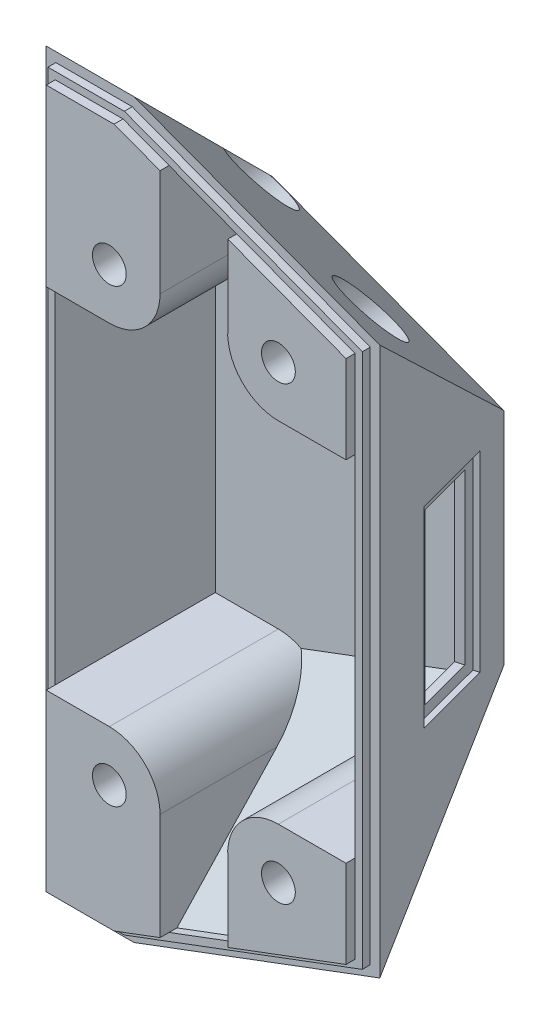
from build123d import *

# Parameters (mm, degrees)
BOSS_EXTRUDE1_DEPTH     = 0.889
SKETCH8_W               = 6.35
SKETCH8_H               = 19.05
CUT_EXTRUDE2_DEPTH      = 5.08
SKETCH9_W               = 8.89
SKETCH9_H               = 21.59
CUT_EXTRUDE3_DEPTH      = 0.635
CUT_EXTRUDE4_DEPTH      = 2.54
CUT_EXTRUDE4_DEPTH_BACK = 0.254
SKETCH10_W              = 11.176
SKETCH10_H              = 30.48
SKETCH10_W_2            = 6.35
SKETCH10_H_2            = 19.05
BOSS_EXTRUDE2_REACH     = 95.096
SKETCH12_R              = 3.81
CUT_EXTRUDE5_DEPTH      = 16.51
SKETCH13_R              = 1.905
CUT_EXTRUDE6_DEPTH      = 93.196752065


with BuildPart() as part:
    # Sketch2 → Boss-Extrude1 (new body)
    with BuildSketch(Plane.XY):
        Polygon((1.0795, 81.4705), (1.0795, 1.0795), (9.69330013, 1.0795), (36.5125, 11.136699951), (36.5125, 71.413300049), (9.69330013, 81.4705), align=None)
        Polygon((9.543608433, 1.905), (1.905, 1.905), (1.905, 80.645), (9.543608433, 80.645), (35.687, 70.841228162), (35.687, 11.708771838), align=None, mode=Mode.SUBTRACT)
    extrude(amount=BOSS_EXTRUDE1_DEPTH)

    # Sketch4 → Loft2 section 0
    with BuildSketch(Plane.XY.offset(-19.05)):
        with BuildLine():
            Line((0, 63.5), (0, 19.05))
            Line((0, 19.05), (6.434627029, 19.05))
            Line((6.434627029, 19.05), (32.512, 28.829014864))
            Line((32.512, 28.829014864), (32.512, 53.720985136))
            Line((32.512, 53.720985136), (6.434627029, 63.5))
            Line((6.434627029, 63.5), (0, 63.5))
        make_face()
    # Sketch2<7> → Loft2 section 1
    with BuildSketch(Plane.XY):
        with BuildLine():
            Line((0, 82.55), (0, 0))
            Line((0, 0), (9.889050811, 0))
            Line((9.889050811, 0), (37.592, 10.388605946))
            Line((37.592, 10.388605946), (37.592, 72.161394054))
            Line((37.592, 72.161394054), (9.889050811, 82.55))
            Line((9.889050811, 82.55), (0, 82.55))
        make_face()
    loft()

    # Sketch2<8> → Cut-Loft1 section 0
    with BuildSketch(Plane.XY):
        with BuildLine():
            Line((1.905, 1.905), (1.905, 80.645))
            Line((1.905, 80.645), (9.543608433, 80.645))
            Line((9.543608433, 80.645), (35.687, 70.841228162))
            Line((35.687, 70.841228162), (35.687, 11.708771838))
            Line((35.687, 11.708771838), (9.543608433, 1.905))
            Line((9.543608433, 1.905), (1.905, 1.905))
        make_face()
    # Sketch5 → Cut-Loft1 section 1
    with BuildSketch(Plane.XY.offset(-17.145)):
        with BuildLine():
            Line((31.115, 28.305139864), (31.115, 54.244860136))
            Line((31.115, 54.244860136), (6.434627029, 63.5))
            Line((6.434627029, 63.5), (1.905, 63.5))
            Line((1.905, 63.5), (1.905, 19.05))
            Line((1.905, 19.05), (6.434627029, 19.05))
            Line((6.434627029, 19.05), (31.115, 28.305139864))
        make_face()
    loft(mode=Mode.SUBTRACT)

    # Sketch8 → Cut-Extrude2 (cut)
    with BuildSketch(Plane(origin=(35.09626556, 0, -9.359004149), x_dir=(-0.257662650560332, 0, -0.9662349396012465), z_dir=(0.9662349396012465, 0, -0.257662650560332))):
        with Locations((1.774647504, 41.275)):
            Rectangle(SKETCH8_W, SKETCH8_H)
    extrude(amount=-CUT_EXTRUDE2_DEPTH, mode=Mode.SUBTRACT)

    # Sketch9 → Cut-Extrude3 (cut)
    with BuildSketch(Plane(origin=(35.09626556, 0, -9.359004149), x_dir=(-0.257662650560332, 0, -0.9662349396012465), z_dir=(0.9662349396012465, 0, -0.257662650560332))):
        with Locations((1.774647504, 41.275)):
            Rectangle(SKETCH9_W, SKETCH9_H)
    extrude(amount=-CUT_EXTRUDE3_DEPTH, mode=Mode.SUBTRACT)

    # Sketch10 → Cut-Extrude4 (cut, two sides: drawn at the far end of the back side and taken through both)
    with BuildSketch(Plane(origin=(33.317738589, 0, -8.88473029), x_dir=(0.25766265056032145, 0, 0.9662349396012492), z_dir=(-0.9662349396012492, 0, 0.25766265056032145)).offset(-CUT_EXTRUDE4_DEPTH_BACK)):
        with Locations((-1.774647504, 41.275)):
            Rectangle(SKETCH10_W, SKETCH10_H)
        with Locations((-1.774647504, 41.275)):
            Rectangle(SKETCH10_W_2, SKETCH10_H_2, mode=Mode.SUBTRACT)
    extrude(amount=CUT_EXTRUDE4_DEPTH + CUT_EXTRUDE4_DEPTH_BACK, mode=Mode.SUBTRACT)

    # Sketch11 → Boss-Extrude2 (add, up to next)
    with BuildSketch(Plane.XY.offset(1.905), mode=Mode.PRIVATE) as boss_extrude2_sk1:
        with BuildLine():
            ThreePointArc((14.732, 15.875), (13.058115254, 19.916115254), (9.017, 21.59))
            Line((9.017, 21.59), (1.905, 21.59))
            Line((1.905, 21.59), (1.905, 1.905))
            Line((1.905, 1.905), (9.543608433, 1.905))
            Line((9.543608433, 1.905), (14.732, 3.850646838))
            Line((14.732, 3.850646838), (14.732, 15.875))
        make_face()
    boss_extrude2_tool1 = extrude(boss_extrude2_sk1.sketch, amount=-BOSS_EXTRUDE2_REACH, mode=Mode.PRIVATE) - part.part
    # Sketch11 → Boss-Extrude2 (add, up to next)
    with BuildSketch(Plane.XY.offset(1.905), mode=Mode.PRIVATE) as boss_extrude2_sk2:
        with BuildLine():
            ThreePointArc((28.067, 21.59), (23.903603678, 19.790016738), (22.362794824, 15.523904134))
            Line((22.362794824, 15.523904134), (22.362794824, 6.712194896))
            Line((22.362794824, 6.712194896), (35.687, 11.708771838))
            Line((35.687, 11.708771838), (35.687, 21.59))
            Line((35.687, 21.59), (28.067, 21.59))
        make_face()
    boss_extrude2_tool2 = extrude(boss_extrude2_sk2.sketch, amount=-BOSS_EXTRUDE2_REACH, mode=Mode.PRIVATE) - part.part
    # Sketch11 → Boss-Extrude2 (add, up to next)
    with BuildSketch(Plane.XY.offset(1.905), mode=Mode.PRIVATE) as boss_extrude2_sk3:
        with BuildLine():
            Line((1.905, 60.96), (9.017, 60.96))
            ThreePointArc((9.017, 60.96), (13.058115254, 62.633884746), (14.732, 66.675))
            Line((14.732, 66.675), (14.732, 78.699353162))
            Line((14.732, 78.699353162), (9.543608433, 80.645))
            Line((9.543608433, 80.645), (1.905, 80.645))
            Line((1.905, 80.645), (1.905, 60.96))
        make_face()
    boss_extrude2_tool3 = extrude(boss_extrude2_sk3.sketch, amount=-BOSS_EXTRUDE2_REACH, mode=Mode.PRIVATE) - part.part
    # Sketch11 → Boss-Extrude2 (add, up to next)
    with BuildSketch(Plane.XY.offset(1.905), mode=Mode.PRIVATE) as boss_extrude2_sk4:
        with BuildLine():
            Line((28.067, 60.96), (35.687, 60.96))
            Line((35.687, 60.96), (35.687, 70.841228162))
            Line((35.687, 70.841228162), (22.362794824, 75.837805104))
            Line((22.362794824, 75.837805104), (22.362794824, 67.026095866))
            ThreePointArc((22.362794824, 67.026095866), (23.903603678, 62.759983262), (28.067, 60.96))
        make_face()
    boss_extrude2_tool4 = extrude(boss_extrude2_sk4.sketch, amount=-BOSS_EXTRUDE2_REACH, mode=Mode.PRIVATE) - part.part
    add(boss_extrude2_tool1.solids().sort_by_distance((8.070425, 11.690794, 1.905))[0])
    add(boss_extrude2_tool2.solids().sort_by_distance((28.793721, 15.09587, 1.905))[0])
    add(boss_extrude2_tool3.solids().sort_by_distance((8.070425, 70.859206, 1.905))[0])
    add(boss_extrude2_tool4.solids().sort_by_distance((28.793721, 67.45413, 1.905))[0])

    # Sketch12 → Cut-Extrude5 (cut)
    with BuildSketch(Plane(origin=(0, 0, -19.05), x_dir=(-1, 0, 0), z_dir=(0, 0, -1))):
        with Locations((-28.067, 15.875)):
            Circle(SKETCH12_R)
        with Locations((-9.017, 15.875)):
            Circle(SKETCH12_R)
        with Locations((-9.017, 66.675)):
            Circle(SKETCH12_R)
        with Locations((-28.067, 66.675)):
            Circle(SKETCH12_R)
    extrude(amount=-CUT_EXTRUDE5_DEPTH, mode=Mode.SUBTRACT)

    # Sketch13 → Cut-Extrude6 (cut, through all)
    with BuildSketch(Plane(origin=(0, 0, -2.54), x_dir=(-1, 0, 0), z_dir=(0, 0, -1))):
        with Locations((-9.017, 15.875)):
            Circle(SKETCH13_R)
        with Locations((-28.067, 15.875)):
            Circle(SKETCH13_R)
        with Locations((-9.017, 66.675)):
            Circle(SKETCH13_R)
        with Locations((-28.067, 66.675)):
            Circle(SKETCH13_R)
    extrude(amount=-CUT_EXTRUDE6_DEPTH, mode=Mode.SUBTRACT)


solid = part.part
